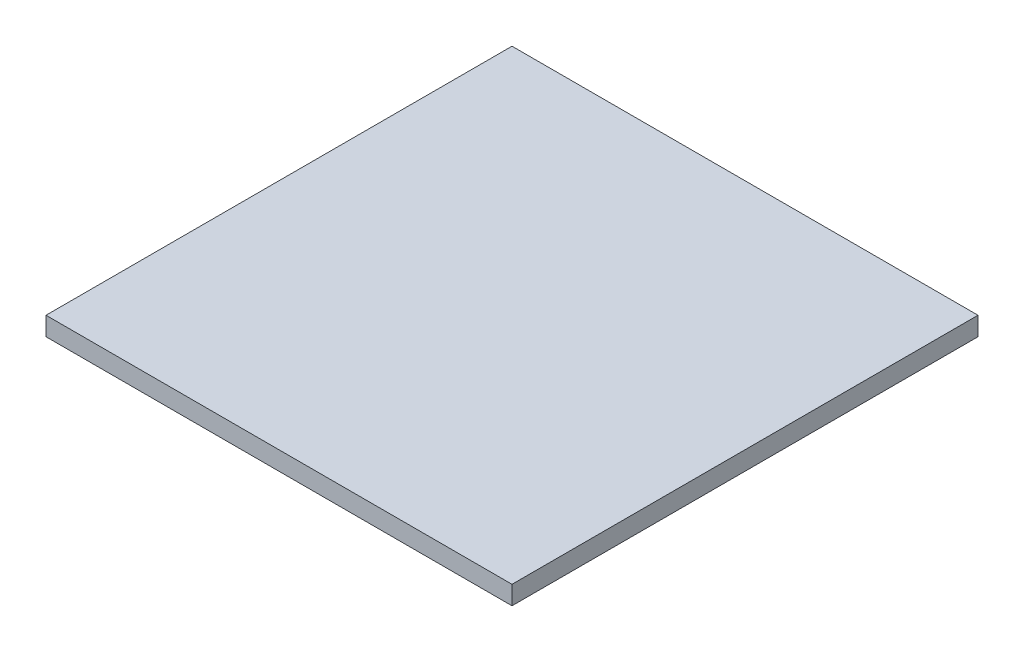
from build123d import *

# Parameters (mm, degrees)
SKETCH1_W           = 500
SKETCH1_H           = 500
BOSS_EXTRUDE1_DEPTH = 20


with BuildPart() as part:
    # Sketch1 → Boss-Extrude1 (new body)
    with BuildSketch(Plane(origin=(0, 0, 0), x_dir=(1, 0, 0), z_dir=(0, 1, 0))):
        Rectangle(SKETCH1_W, SKETCH1_H)
    extrude(amount=BOSS_EXTRUDE1_DEPTH)


solid = part.part
